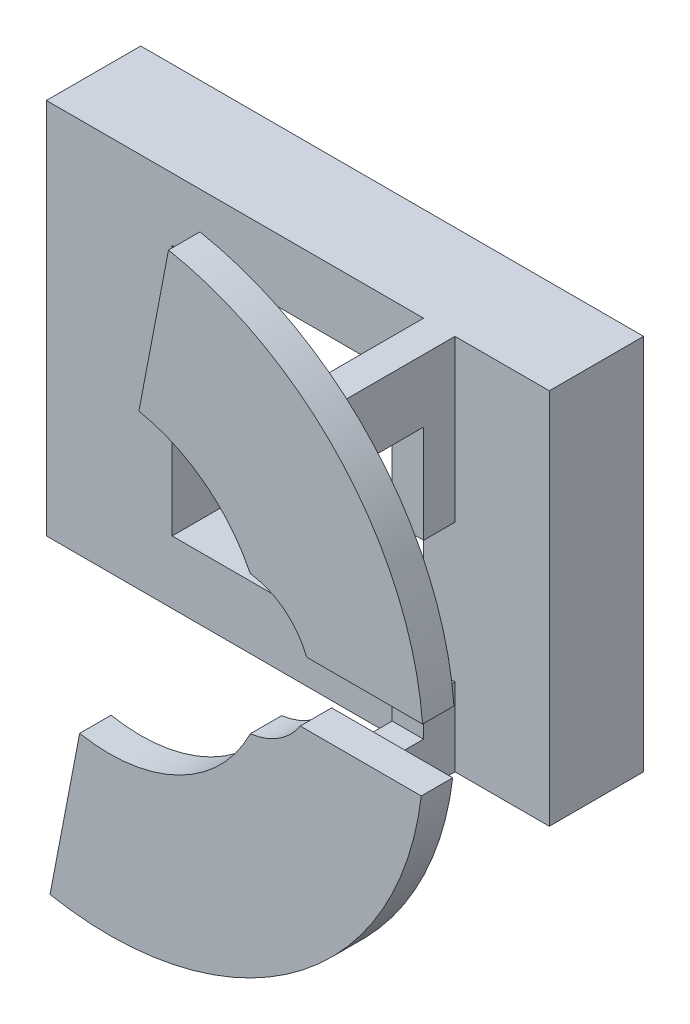
from build123d import *

# Parameters (mm, degrees)
SKETCH2_W           = 60
SKETCH2_H           = 80
SKETCH2_W_2         = 40
SKETCH2_H_2         = 40
BOSS_EXTRUDE1_DEPTH = 15
SKETCH6_W           = 5
SKETCH6_H           = 25.6
SKETCH6_H_2         = 12.4
BOSS_EXTRUDE4_DEPTH = 5
SKETCH8_W           = 5
SKETCH8_H           = 7
BOSS_EXTRUDE5_DEPTH = 20
SKETCH9_W           = 5
SKETCH9_H           = 10
BOSS_EXTRUDE6_DEPTH = 20
BOSS_EXTRUDE7_DEPTH = 5


with BuildPart() as part:
    # Sketch2 → Boss-Extrude1 (new body)
    with BuildSketch(Plane(origin=(0, 0, 0), x_dir=(0, 1, 0), z_dir=(0, 0, 1))):
        Rectangle(SKETCH2_W, SKETCH2_H)
        Rectangle(SKETCH2_W_2, SKETCH2_H_2, mode=Mode.SUBTRACT)
    extrude(amount=BOSS_EXTRUDE1_DEPTH)

    # Sketch6 → Boss-Extrude4 (add)
    with BuildSketch(Plane.XY.offset(15)):
        with Locations((22.5, 17.2)):
            Rectangle(SKETCH6_W, SKETCH6_H)
        with Locations((22.5, -23.8)):
            Rectangle(SKETCH6_W, SKETCH6_H_2)
    extrude(amount=BOSS_EXTRUDE4_DEPTH)

    # Sketch8 → Boss-Extrude5 (add)
    with BuildSketch(Plane.XY.offset(20)):
        with Locations((22.5, -26.5)):
            Rectangle(SKETCH8_W, SKETCH8_H)
    extrude(amount=BOSS_EXTRUDE5_DEPTH)

    # Sketch9 → Boss-Extrude6 (add)
    with BuildSketch(Plane.XY.offset(20)):
        with Locations((22.5, 25)):
            Rectangle(SKETCH9_W, SKETCH9_H)
    extrude(amount=BOSS_EXTRUDE6_DEPTH)

    # Sketch10 → Boss-Extrude7 (add)
    with BuildSketch(Plane.XY.offset(40)):
        with BuildLine():
            Line((-9.424890685, -49.103680469), (-4.712445342, -24.551840234))
            ThreePointArc((-4.712445342, -24.551840234), (11.141961637, -22.379827767), (22.431197476, -11.038178282))
            ThreePointArc((22.431197476, -11.038178282), (26.961461335, -9.399504495), (30.374950987, -6))
            Line((30.374950987, -6), (49.638694584, -6))
            ThreePointArc((49.638694584, -6), (29.474893104, -40.388496834), (-9.424890685, -49.103680469))
        make_face()
        with BuildLine():
            Line((4.712445342, 24.551840234), (9.424890685, 49.103680469))
            ThreePointArc((9.424890685, 49.103680469), (37.23787997, 33.366754342), (49.839743178, 4))
            Line((49.839743178, 4), (31.386996968, 4))
            ThreePointArc((31.386996968, 4), (27.877602661, 8.751473456), (22.431197476, 11.038178282))
            ThreePointArc((22.431197476, 11.038178282), (15.160775086, 19.878402823), (4.712445342, 24.551840234))
        make_face()
    extrude(amount=BOSS_EXTRUDE7_DEPTH)


solid = part.part
